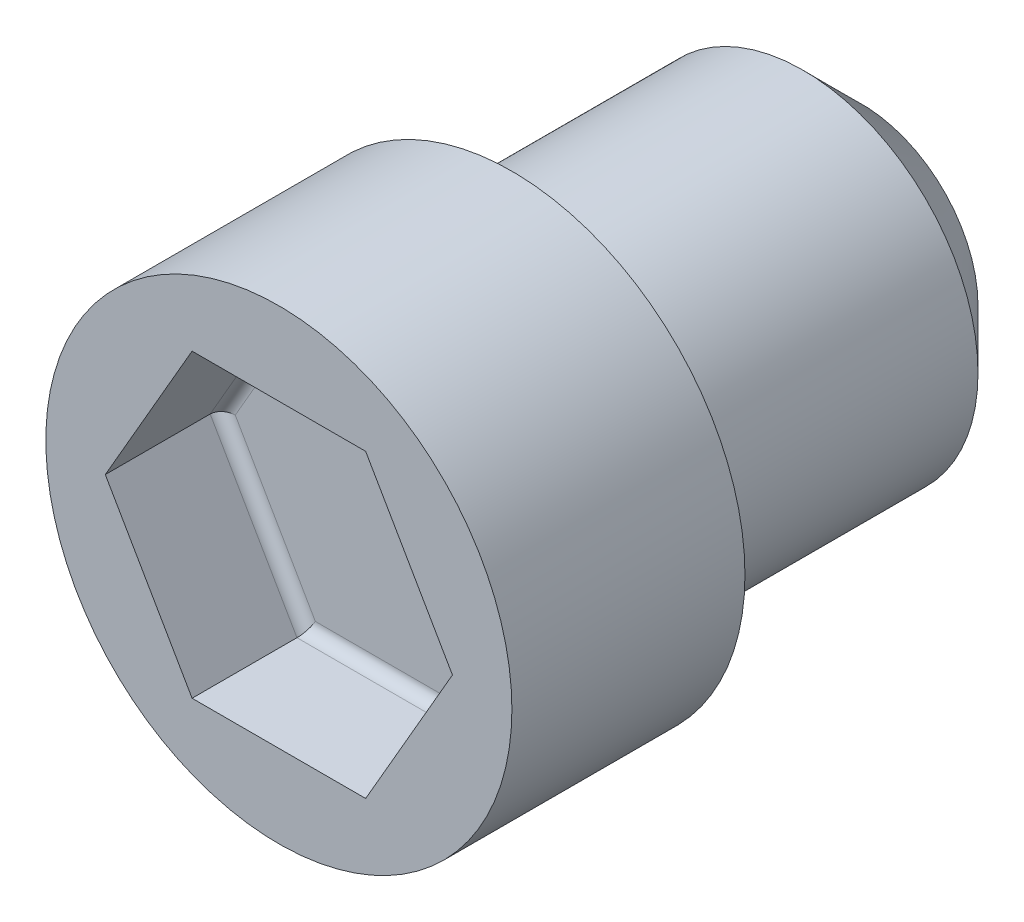
from build123d import *

# Parameters (mm, degrees)
SKETCH3_R           = 1.5
BOSS_EXTRUDE1_DEPTH = 3
SKETCH4_R           = 2
BOSS_EXTRUDE2_DEPTH = 2
CUT_EXTRUDE1_DEPTH  = 1
CHAMFER3_SIZE       = 0.5
FILLET1_R           = 0.1


with BuildPart() as part:
    # Sketch3 → Boss-Extrude1 (new body)
    with BuildSketch(Plane(origin=(0, 0, 0), x_dir=(0, 1, 0), z_dir=(0, 0, 1))):
        with Locations(Location((0, 0, 0), (0, 0, 270))):
            Circle(SKETCH3_R)
    extrude(amount=BOSS_EXTRUDE1_DEPTH)

    # Sketch4 → Boss-Extrude2 (add)
    with BuildSketch(Plane.XY.offset(3)):
        Circle(SKETCH4_R)
    extrude(amount=BOSS_EXTRUDE2_DEPTH)

    # Sketch5 → Cut-Extrude1 (cut)
    with BuildSketch(Plane.XY.offset(5)):
        Polygon((1.489563695, 0), (0.744781847, 1.29), (-0.744781847, 1.29), (-1.489563695, 0), (-0.744781847, -1.29), (0.744781847, -1.29), align=None)
    extrude(amount=-CUT_EXTRUDE1_DEPTH, mode=Mode.SUBTRACT)

    # Chamfer3
    chamfer3_edges = [part.edges().sort_by_distance(p)[0] for p in [
        (-1.5, 0, 0),
    ]]
    chamfer(chamfer3_edges, length=CHAMFER3_SIZE)

    # Fillet1
    fillet1_edges = [part.edges().sort_by_distance(p)[0] for p in [
        (1.117172771, -0.645, 4),
        (0, -1.29, 4),
        (-1.117172771, -0.645, 4),
        (-1.117172771, 0.645, 4),
        (0, 1.29, 4),
        (1.117172771, 0.645, 4),
    ]]
    fillet(fillet1_edges, radius=FILLET1_R)


solid = part.part
